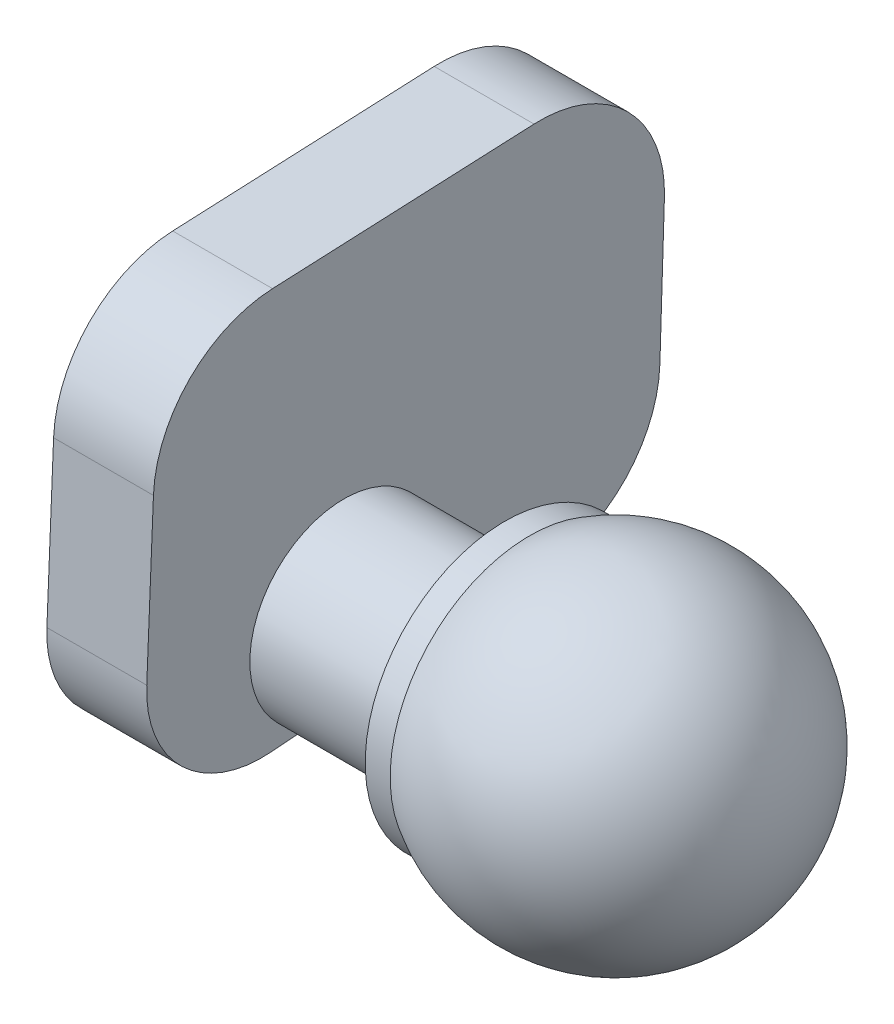
from build123d import *

# Parameters (mm, degrees)
BOSS_EXTRUDE1_DEPTH = 4
SKETCH2_R           = 3.769998475
BOSS_EXTRUDE3_DEPTH = 6
SKETCH3_R           = 5.590277894
BOSS_EXTRUDE4_DEPTH = 1
DOME2_FACE_RADIUS   = 5.590277894
DOME2_HEIGHT        = 10


with BuildPart() as part:
    # Sketch1 → Boss-Extrude1 (new body)
    with BuildSketch(Plane(origin=(0, 0, 0), x_dir=(0, 0, -1), z_dir=(1, 0, 0))):
        with BuildLine():
            Line((19.618899977, 26.910578021), (30.093333643, 27.382443553))
            ThreePointArc((30.093333643, 27.382443553), (33.830584617, 25.946191816), (35.315810998, 22.228132309))
            Line((35.315810998, 22.228132309), (35.134279712, 16.536003005))
            ThreePointArc((35.134279712, 16.536003005), (33.751052045, 13.24033598), (30.52098964, 11.710160572))
            Line((30.52098964, 11.710160572), (19.560243471, 10.86550754))
            ThreePointArc((19.560243471, 10.86550754), (15.990018512, 12.15019262), (14.579969631, 15.672788846))
            Line((14.579969631, 15.672788846), (14.848236342, 22.1234032))
            ThreePointArc((14.848236342, 22.1234032), (16.302281821, 25.445064899), (19.618899977, 26.910578021))
        make_face()
    extrude(amount=BOSS_EXTRUDE1_DEPTH)

    # Sketch2 → Boss-Extrude3 (add)
    with BuildSketch(Plane(origin=(4, 0, 0), x_dir=(0, 0, -1), z_dir=(1, 0, 0))):
        with Locations(Location((22.478500698, 14.418661265, 0), (0, 0, 246.075553506))):
            Circle(SKETCH2_R)
    extrude(amount=BOSS_EXTRUDE3_DEPTH)

    # Sketch3 → Boss-Extrude4 (add)
    with BuildSketch(Plane(origin=(10, 0, 0), x_dir=(0, 0, -1), z_dir=(1, 0, 0))):
        with Locations((22.920717482, 14.60121679)):
            Circle(SKETCH3_R)
    extrude(amount=BOSS_EXTRUDE4_DEPTH)

    # Dome2: a dome of height H over a round flat face of radius A is a cap of a sphere of radius (A * A + H * H) / (2 * H)
    dome2_r = (DOME2_FACE_RADIUS * DOME2_FACE_RADIUS + DOME2_HEIGHT * DOME2_HEIGHT) / (2 * DOME2_HEIGHT)
    dome2_base = Plane((11, 14.60121679, -22.920717482), z_dir=(1, 0, 0))
    with Locations(dome2_base.offset(DOME2_HEIGHT - dome2_r)):
        dome2_ball = Sphere(dome2_r, mode=Mode.PRIVATE)
    add(split(dome2_ball, bisect_by=dome2_base, keep=Keep.TOP, mode=Mode.PRIVATE))


solid = part.part
